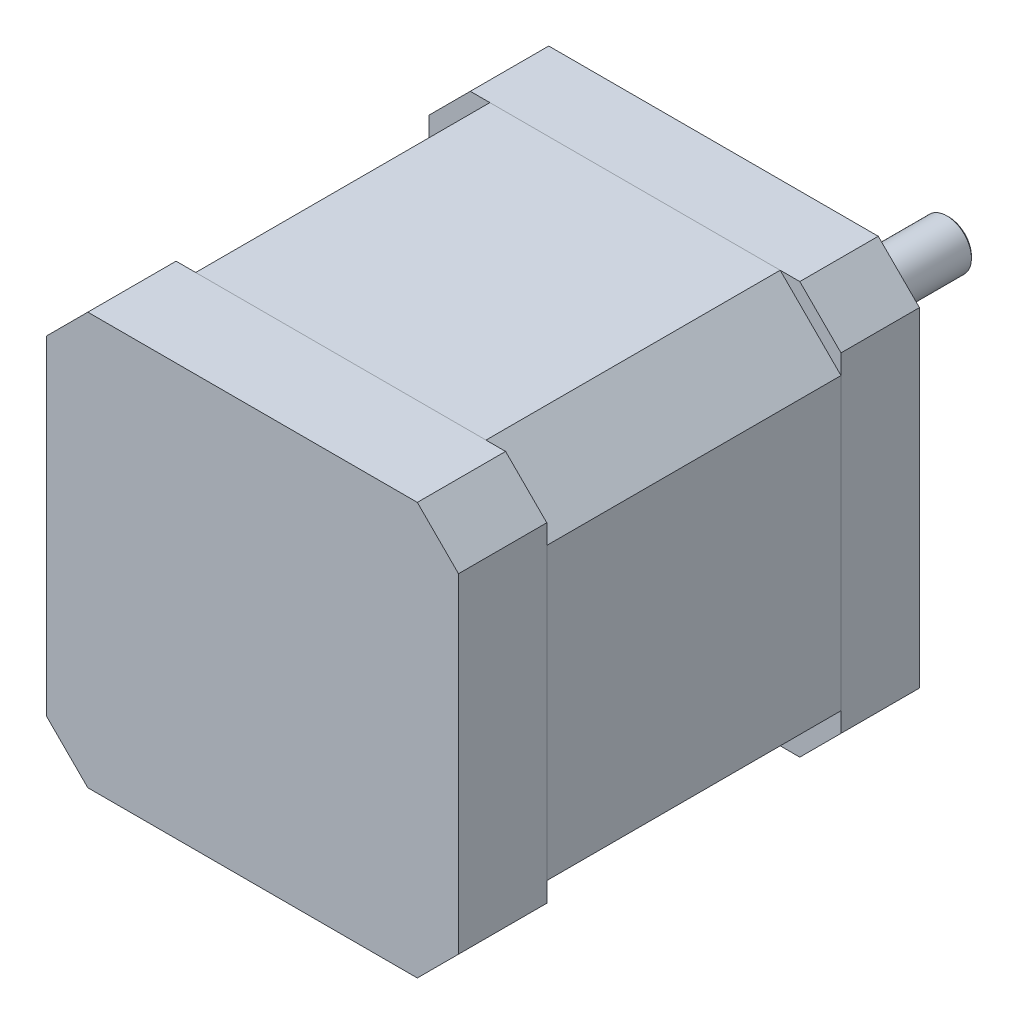
from build123d import *

# Parameters (mm, degrees)
ESQUISSE1_W             = 42
ESQUISSE1_H             = 42
BOSS_EXTRU_1_DEPTH      = 8
CHANFREIN1_SIZE         = 4.2
BOSS_EXTRU_2_DEPTH      = 30
ESQUISSE4_W             = 42
ESQUISSE4_H             = 42
BOSS_EXTRU_3_DEPTH      = 9
CHANFREIN3_SIZE         = 4.2
ESQUISSE5_R             = 11
BOSS_EXTRU_4_DEPTH      = 2
ESQUISSE6_R             = 4.5
ENL_V_MAT_EXTRU_1_DEPTH = 3
ESQUISSE7_R             = 2.5
BOSS_EXTRU_5_DEPTH      = 25
CHANFREIN4_SIZE         = 0.2
ESQUISSE8_R             = 1.5
ENL_V_MAT_EXTRU_2_DEPTH = 5
CHANFREIN5_SIZE         = 0.2
ESQUISSE9_W             = 7
ESQUISSE9_H             = 8
ENL_V_MAT_EXTRU_3_DEPTH = 2


with BuildPart() as part:
    # Esquisse1 → Boss.-Extru.1 (new body)
    with BuildSketch(Plane.XY):
        Rectangle(ESQUISSE1_W, ESQUISSE1_H)
    extrude(amount=BOSS_EXTRU_1_DEPTH)

    # Chanfrein1
    chanfrein1_edges = [part.edges().sort_by_distance(p)[0] for p in [
        (21, -21, 4),
        (-21, -21, 4),
        (-21, 21, 4),
        (21, 21, 4),
    ]]
    chamfer(chanfrein1_edges, length=CHANFREIN1_SIZE)

    # Esquisse5 → Boss.-Extru.4 (add)
    with BuildSketch(Plane(origin=(0, 0, 0), x_dir=(-1, 0, 0), z_dir=(0, 0, -1))):
        with Locations(Location((0, 0, 0), (0, 0, 180))):
            Circle(ESQUISSE5_R)
    extrude(amount=BOSS_EXTRU_4_DEPTH)

    # Esquisse6 → Enlèv. mat.-Extru.1 (cut)
    with BuildSketch(Plane(origin=(0, 0, -2), x_dir=(-1, 0, 0), z_dir=(0, 0, -1))):
        Circle(ESQUISSE6_R)
    extrude(amount=-ENL_V_MAT_EXTRU_1_DEPTH, mode=Mode.SUBTRACT)

    # Esquisse7 → Boss.-Extru.5 (add)
    with BuildSketch(Plane(origin=(0, 0, 1), x_dir=(-1, 0, 0), z_dir=(0, 0, -1))):
        Circle(ESQUISSE7_R)
    extrude(amount=BOSS_EXTRU_5_DEPTH)

    # Chanfrein4
    chanfrein4_edges = [part.edges().sort_by_distance(p)[0] for p in [
        (2.5, 0, -24),
    ]]
    chamfer(chanfrein4_edges, length=CHANFREIN4_SIZE)

    # Esquisse8 → Enlèv. mat.-Extru.2 (cut)
    with BuildSketch(Plane(origin=(0, 0, 0), x_dir=(-1, 0, 0), z_dir=(0, 0, -1))):
        with Locations((-15.5, 15.5)):
            Circle(ESQUISSE8_R)
        with Locations((15.5, 15.5)):
            Circle(ESQUISSE8_R)
        with Locations((15.5, -15.5)):
            Circle(ESQUISSE8_R)
        with Locations((-15.5, -15.5)):
            Circle(ESQUISSE8_R)
    extrude(amount=-ENL_V_MAT_EXTRU_2_DEPTH, mode=Mode.SUBTRACT)

    # Chanfrein5
    chanfrein5_edges = [part.edges().sort_by_distance(p)[0] for p in [
        (17, 15.5, 0),
        (-14, 15.5, 0),
        (-14, -15.5, 0),
        (17, -15.5, 0),
    ]]
    chamfer(chanfrein5_edges, length=CHANFREIN5_SIZE)


with BuildPart() as body_2:
    # Esquisse3 → Boss.-Extru.2 (new body)
    with BuildSketch(Plane.XY.offset(8)):
        Polygon((-21, 14.8), (-14.8, 21), (14.8, 21), (21, 14.8), (21, -14.8), (14.8, -21), (-14.8, -21), (-21, -14.8), align=None)
    extrude(amount=BOSS_EXTRU_2_DEPTH)


with BuildPart() as body_3:
    # Esquisse4 → Boss.-Extru.3 (new body)
    with BuildSketch(Plane.XY.offset(38)):
        Rectangle(ESQUISSE4_W, ESQUISSE4_H)
    extrude(amount=BOSS_EXTRU_3_DEPTH)

    # Chanfrein3
    chanfrein3_edges = [body_3.edges().sort_by_distance(p)[0] for p in [
        (21, -21, 42.5),
        (-21, -21, 42.5),
        (-21, 21, 42.5),
        (21, 21, 42.5),
    ]]
    chamfer(chanfrein3_edges, length=CHANFREIN3_SIZE)

    # Esquisse9 → Enlèv. mat.-Extru.3 (cut)
    with BuildSketch(Plane.ZY.offset(21)):
        with Locations((41.5, 0)):
            Rectangle(ESQUISSE9_W, ESQUISSE9_H)
    extrude(amount=-ENL_V_MAT_EXTRU_3_DEPTH, mode=Mode.SUBTRACT)


solid = Compound([part.part, body_2.part, body_3.part])
